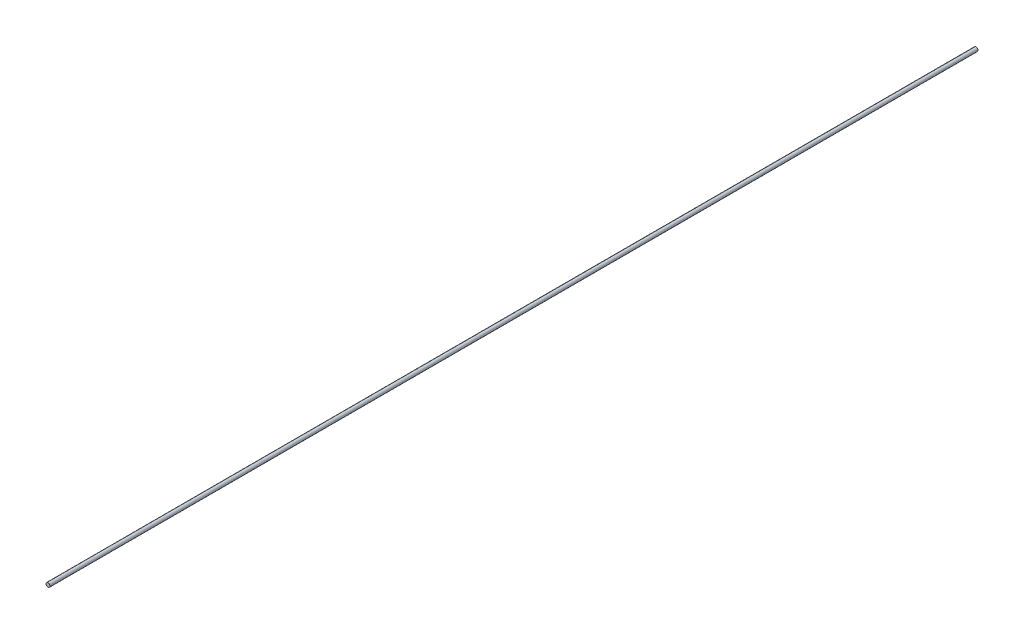
from build123d import *

# Parameters (mm, degrees)
SKETCH1_R           = 2
BOSS_EXTRUDE1_DEPTH = 934.05


with BuildPart() as part:
    # Sketch1 → Boss-Extrude1 (new body)
    with BuildSketch(Plane.XY):
        Circle(SKETCH1_R)
    extrude(amount=BOSS_EXTRUDE1_DEPTH)


solid = part.part
